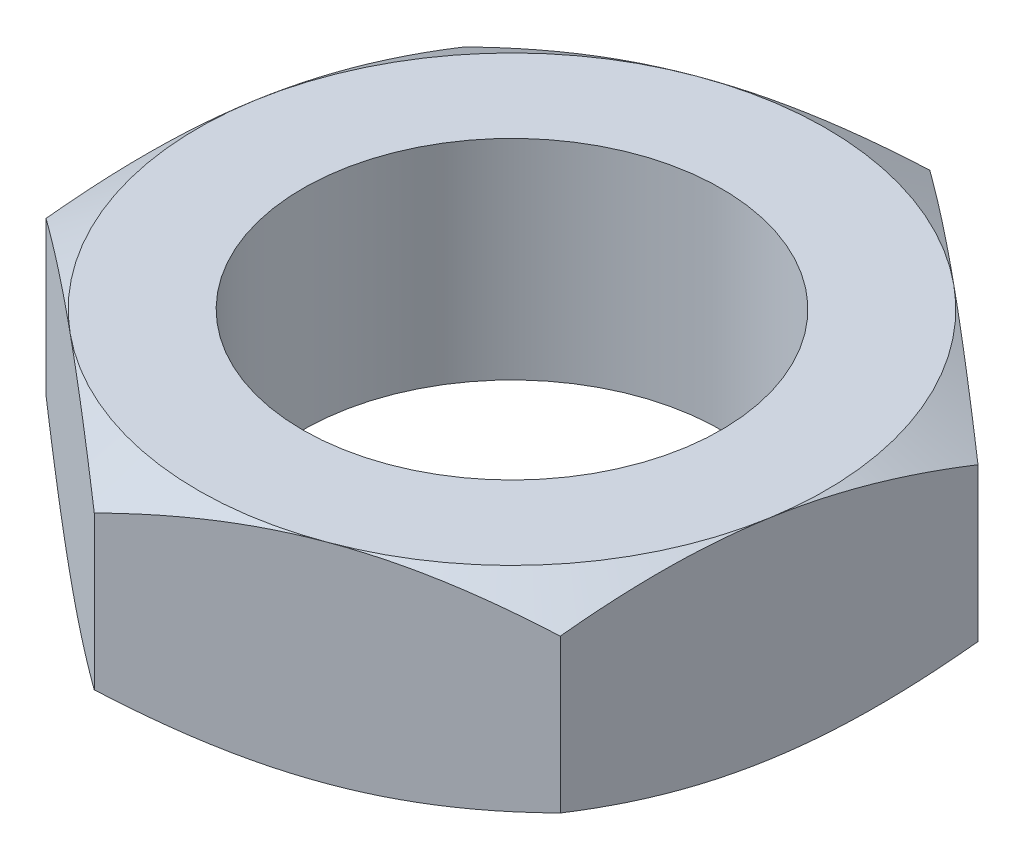
from build123d import *

# Parameters (mm, degrees)
BOSS_EXTRUDE1_DEPTH = 5
SKETCH7_OUTSIDE_W   = 26.516
SKETCH7_OUTSIDE_H   = 27.36
SKETCH7_OUTSIDE_R   = 7.5
CUT_EXTRUDE4_DEPTH  = 1
CUT_EXTRUDE4_DRAFT  = -60
SKETCH8_OUTSIDE_W   = 26.516
SKETCH8_OUTSIDE_H   = 27.36
SKETCH8_OUTSIDE_R   = 7.5
CUT_EXTRUDE5_DEPTH  = 1
CUT_EXTRUDE5_DRAFT  = -60
SKETCH9_R           = 5
CUT_EXTRUDE6_DEPTH  = 9


with BuildPart() as part:
    # Sketch1 → Boss-Extrude1 (new body)
    with BuildSketch(Plane(origin=(0, 0, 0), x_dir=(1, 0, 0), z_dir=(0, 1, 0))):
        Polygon((6.673205692, -5.519812116), (8.116900362, 3.019259596), (1.44369467, 8.539071712), (-6.673205692, 5.519812116), (-8.116900362, -3.019259596), (-1.44369467, -8.539071712), align=None)
    extrude(amount=BOSS_EXTRUDE1_DEPTH)


with BuildPart() as cut_extrude4_tool:
    # Sketch7 outside → Cut-Extrude4 (with draft: the straight prism first)
    with BuildSketch(Plane(origin=(0, 5, 0), x_dir=(1, 0, 0), z_dir=(0, 1, 0))):
        Rectangle(SKETCH7_OUTSIDE_W, SKETCH7_OUTSIDE_H)
        Circle(SKETCH7_OUTSIDE_R, mode=Mode.SUBTRACT)
    extrude(amount=-CUT_EXTRUDE4_DEPTH)
    # Cut-Extrude4: the draft: its side faces are tilted about the plane it starts from
    cut_extrude4_sides = [cut_extrude4_tool.faces().sort_by_distance(p)[0] for p in [
        (0, 4.5, 13.68),
        (13.258, 4.5, 0),
        (0, 4.5, -13.68),
        (-13.258, 4.5, 0),
        (-7.5, 4.5, 0),
    ]]
    draft(cut_extrude4_sides, Plane(origin=(0, 5, 0), x_dir=(1, 0, 0), z_dir=(0, 1, 0)), CUT_EXTRUDE4_DRAFT)


with BuildPart() as part_1:
    add(part.part)

    # Cut-Extrude4: cut by cut_extrude4_tool
    add(cut_extrude4_tool.part, mode=Mode.SUBTRACT)


with BuildPart() as cut_extrude5_tool:
    # Sketch8 outside → Cut-Extrude5 (with draft: the straight prism first)
    with BuildSketch(Plane.XZ):
        Rectangle(SKETCH8_OUTSIDE_W, SKETCH8_OUTSIDE_H)
        Circle(SKETCH8_OUTSIDE_R, mode=Mode.SUBTRACT)
    extrude(amount=-CUT_EXTRUDE5_DEPTH)
    # Cut-Extrude5: the draft: its side faces are tilted about the plane it starts from
    cut_extrude5_sides = [cut_extrude5_tool.faces().sort_by_distance(p)[0] for p in [
        (0, 0.5, -13.68),
        (13.258, 0.5, 0),
        (0, 0.5, 13.68),
        (-13.258, 0.5, 0),
        (-7.5, 0.5, 0),
    ]]
    draft(cut_extrude5_sides, Plane.XZ, CUT_EXTRUDE5_DRAFT)


with BuildPart() as part_2:
    add(part_1.part)

    # Cut-Extrude5: cut by cut_extrude5_tool
    add(cut_extrude5_tool.part, mode=Mode.SUBTRACT)

    # Sketch9 → Cut-Extrude6 (cut)
    with BuildSketch(Plane(origin=(0, 5, 0), x_dir=(1, 0, 0), z_dir=(0, 1, 0))):
        with Locations(Location((0, 0, 0), (0, 0, 270))):
            Circle(SKETCH9_R)
    extrude(amount=-CUT_EXTRUDE6_DEPTH, mode=Mode.SUBTRACT)


solid = part_2.part
